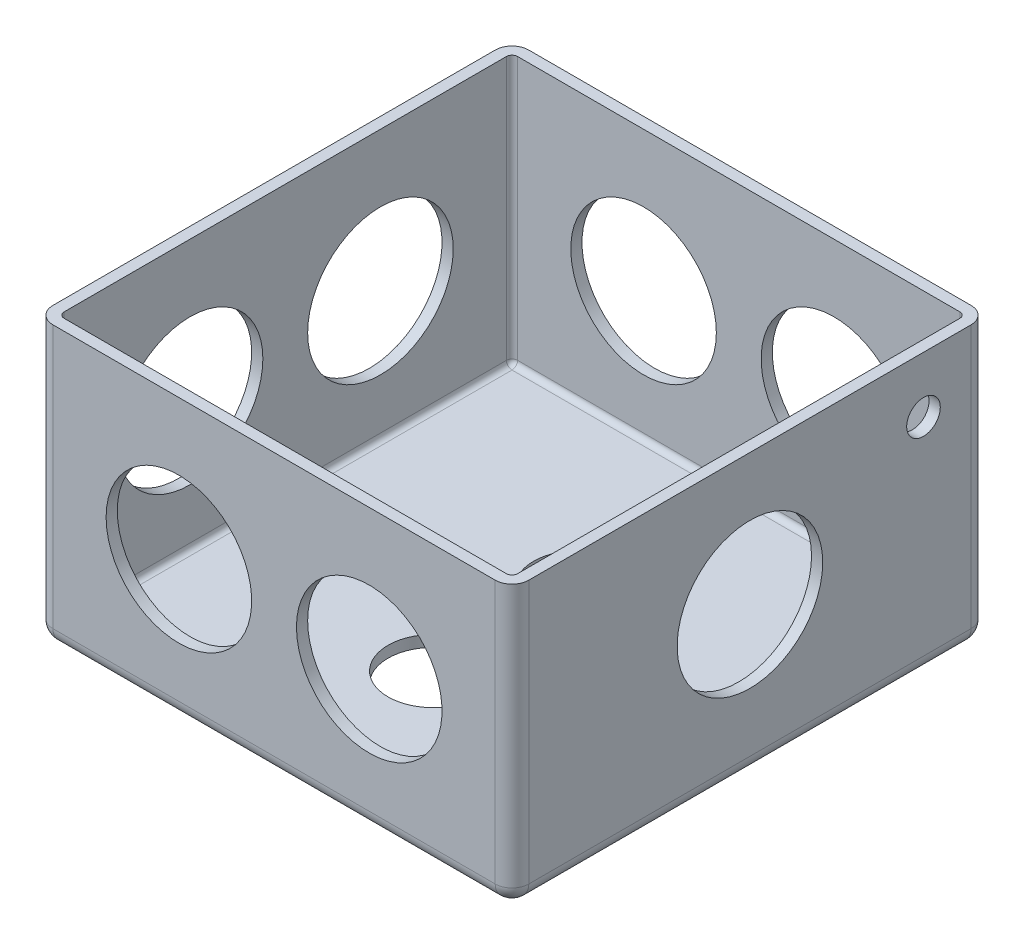
from build123d import *

# Parameters (mm, degrees)
SKETCH1_W               = 85
SKETCH1_H               = 85
BOSS_EXTRUDE1_DEPTH     = 50
FILLET1_R               = 3
SHELL2_T                = -2
SKETCH2_R               = 8
CUT_EXTRUDE1_DEPTH      = 50
CUT_EXTRUDE2_DEPTH      = 108.383657975
CUT_EXTRUDE2_DEPTH_BACK = 108.383657975
SKETCH3_R               = 13
SKETCH4_R               = 13
SKETCH4_R_2             = 3
CUT_EXTRUDE3_DEPTH      = 50
SKETCH5_R               = 13
CUT_EXTRUDE4_DEPTH      = 50


with BuildPart() as part:
    # Sketch1 → Boss-Extrude1 (new body)
    with BuildSketch(Plane(origin=(0, 0, 0), x_dir=(1, 0, 0), z_dir=(0, 1, 0))):
        Rectangle(SKETCH1_W, SKETCH1_H)
    extrude(amount=BOSS_EXTRUDE1_DEPTH)

    # Fillet1
    fillet1_edges = [part.edges().sort_by_distance(p)[0] for p in [
        (0, 0, 42.5),
        (-42.5, 0, 0),
        (0, 0, -42.5),
        (42.5, 0, 0),
        (42.5, 25, 42.5),
        (-42.5, 25, 42.5),
        (-42.5, 25, -42.5),
        (42.5, 25, -42.5),
    ]]
    fillet(fillet1_edges, radius=FILLET1_R)

    # Shell2
    shell2_openings = [part.faces().sort_by_distance(p)[0] for p in [
        (0, 50, 0),
    ]]
    offset(amount=SHELL2_T, openings=shell2_openings, kind=Kind.INTERSECTION)

    # Sketch2 → Cut-Extrude1 (cut)
    with BuildSketch(Plane.XZ):
        with Locations(Location((0, 14.13265191, 0), (0, 0, 270))):
            Circle(SKETCH2_R)
        with Locations(Location((0, -11.86734809, 0), (0, 0, 270))):
            Circle(SKETCH2_R)
    extrude(amount=-CUT_EXTRUDE1_DEPTH, mode=Mode.SUBTRACT)

    # Sketch3 → Cut-Extrude2 (cut, two sides: drawn at the far end of the back side and taken through both)
    with BuildSketch(Plane.XY.offset(42.5).offset(-CUT_EXTRUDE2_DEPTH_BACK)):
        with Locations(Location((-17, 25, 0), (0, 0, 180))):
            Circle(SKETCH3_R)
        with Locations(Location((17, 25, 0), (0, 0, 180))):
            Circle(SKETCH3_R)
    extrude(amount=CUT_EXTRUDE2_DEPTH + CUT_EXTRUDE2_DEPTH_BACK, mode=Mode.SUBTRACT)

    # Sketch4 → Cut-Extrude3 (cut)
    with BuildSketch(Plane(origin=(42.5, 0, 0), x_dir=(0, 0, -1), z_dir=(1, 0, 0))):
        with Locations((0, 26.5)):
            Circle(SKETCH4_R)
        with Locations((30.997938674, 40)):
            Circle(SKETCH4_R_2)
    extrude(amount=-CUT_EXTRUDE3_DEPTH, mode=Mode.SUBTRACT)

    # Sketch5 → Cut-Extrude4 (cut)
    with BuildSketch(Plane.ZY.offset(42.5)):
        with Locations((-17, 25)):
            Circle(SKETCH5_R)
        with Locations((17, 25)):
            Circle(SKETCH5_R)
    extrude(amount=-CUT_EXTRUDE4_DEPTH, mode=Mode.SUBTRACT)


solid = part.part
